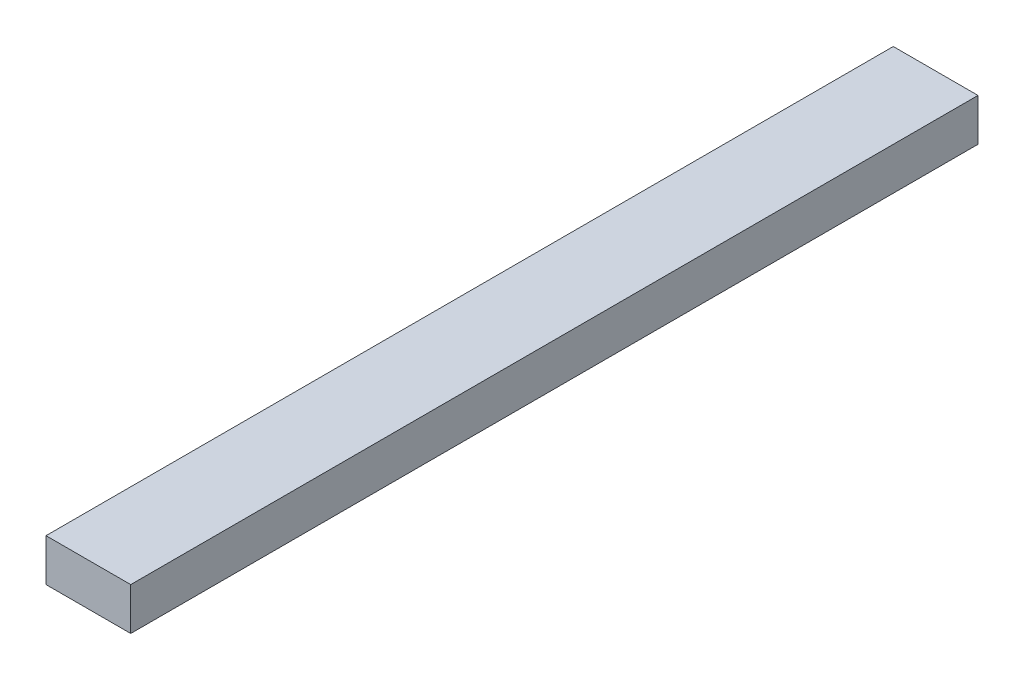
from build123d import *

# Parameters (mm, degrees)
SKETCH1_W           = 101.6
SKETCH1_H           = 50.8
BOSS_EXTRUDE1_DEPTH = 1016


with BuildPart() as part:
    # Sketch1 → Boss-Extrude1 (new body)
    with BuildSketch(Plane.XY):
        with Locations((50.8, 25.4)):
            Rectangle(SKETCH1_W, SKETCH1_H)
    extrude(amount=BOSS_EXTRUDE1_DEPTH)


solid = part.part
